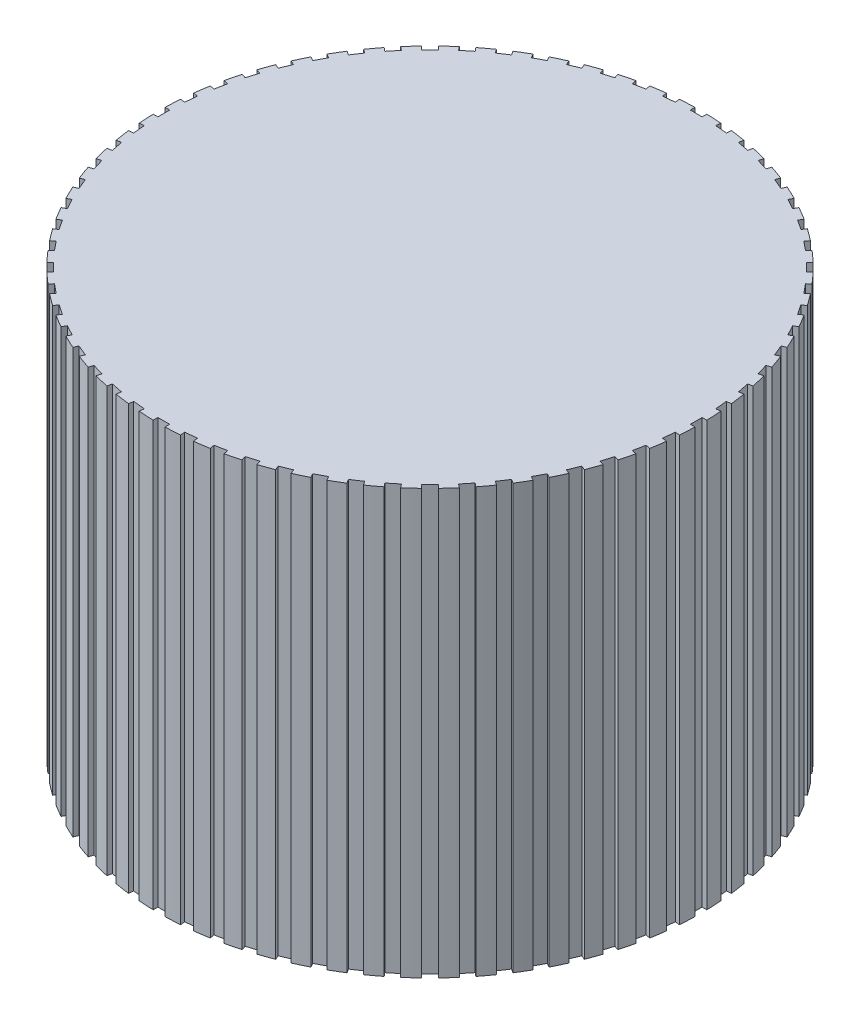
from build123d import *

# Parameters (mm, degrees)
SKETCH1_R           = 5.75
BOSS_EXTRUDE1_DEPTH = 5
BOSS_EXTRUDE2_START = -4
SKETCH1_3_R         = 5.75
SKETCH1_3_R_2       = 2.375
BOSS_EXTRUDE2_DEPTH = 4
SKETCH2_W           = 0.25
SKETCH2_H           = 0.5
SKETCH2_W_2         = 0.5
SKETCH2_H_2         = 0.25
CUT_EXTRUDE1_DEPTH  = 13.129509471


with BuildPart() as part:
    # Sketch1 → Boss-Extrude1 (new body)
    with BuildSketch(Plane(origin=(0, 0, 0), x_dir=(1, 0, 0), z_dir=(0, 1, 0))):
        Circle(SKETCH1_R)
    extrude(amount=BOSS_EXTRUDE1_DEPTH)

    # Sketch1<3> → Boss-Extrude2 (add)
    with BuildSketch(Plane(origin=(0, 0, 0), x_dir=(1, 0, 0), z_dir=(0, 1, 0)).offset(BOSS_EXTRUDE2_START)):
        Circle(SKETCH1_3_R)
        Circle(SKETCH1_3_R_2, mode=Mode.SUBTRACT)
    extrude(amount=BOSS_EXTRUDE2_DEPTH)

    # Sketch2 → Cut-Extrude1 (cut, through all)
    with BuildSketch(Plane.XZ.offset(4)):
        Polygon((0.478407322, 6.132638212), (0.429398752, 5.635045848), (0.678194934, 5.610541563), (0.727203504, 6.108133926), align=None)
        with Locations((0, 5.9)):
            Rectangle(SKETCH2_W, SKETCH2_H)
        Polygon((1.07720732, 6.056215765), (0.979662159, 5.565823125), (1.224858479, 5.517050544), (1.32240364, 6.007443184), align=None)
        Polygon((1.665633223, 5.921468649), (1.520490885, 5.442998482), (1.759725968, 5.370427312), (1.904868307, 5.84889748), align=None)
        Polygon((2.238018167, 5.729694554), (2.046676451, 5.267754788), (2.277646334, 5.17208393), (2.468988051, 5.634023696), align=None)
        Polygon((2.788849773, 5.482740368), (2.553151405, 5.041779736), (2.773631721, 4.923930551), (3.00933009, 5.364891184), align=None)
        Polygon((3.312823232, 5.182984395), (3.035038115, 4.767249589), (3.242905518, 4.62835703), (3.520690635, 5.044091837), align=None)
        Polygon((3.804892391, 4.833313449), (3.487695749, 4.446808222), (3.680948362, 4.288209901), (3.998145004, 4.674715128), align=None)
        Polygon((4.260318357, 4.437095052), (3.906764966, 4.083541661), (4.083541661, 3.906764966), (4.437095052, 4.260318357), align=None)
        Polygon((4.674715128, 3.998145004), (4.288209901, 3.680948362), (4.446808222, 3.487695749), (4.833313449, 3.804892391), align=None)
        Polygon((5.044091837, 3.520690635), (4.62835703, 3.242905518), (4.767249589, 3.035038115), (5.182984395, 3.312823232), align=None)
        Polygon((5.364891184, 3.00933009), (4.923930551, 2.773631721), (5.041779736, 2.553151405), (5.482740368, 2.788849773), align=None)
        Polygon((5.634023696, 2.468988051), (5.17208393, 2.277646334), (5.267754788, 2.046676451), (5.729694554, 2.238018167), align=None)
        Polygon((5.84889748, 1.904868307), (5.370427312, 1.759725968), (5.442998482, 1.520490885), (5.921468649, 1.665633223), align=None)
        Polygon((6.007443184, 1.32240364), (5.517050544, 1.224858479), (5.565823125, 0.979662159), (6.056215765, 1.07720732), align=None)
        Polygon((6.108133926, 0.727203504), (5.610541563, 0.678194934), (5.635045848, 0.429398752), (6.132638212, 0.478407322), align=None)
        with Locations((5.9, 0)):
            Rectangle(SKETCH2_W_2, SKETCH2_H_2)
        Polygon((6.132638212, -0.478407322), (5.635045848, -0.429398752), (5.610541563, -0.678194934), (6.108133926, -0.727203504), align=None)
        Polygon((6.056215765, -1.07720732), (5.565823125, -0.979662159), (5.517050544, -1.224858479), (6.007443184, -1.32240364), align=None)
        Polygon((5.921468649, -1.665633223), (5.442998482, -1.520490885), (5.370427312, -1.759725968), (5.84889748, -1.904868307), align=None)
        Polygon((5.729694554, -2.238018167), (5.267754788, -2.046676451), (5.17208393, -2.277646334), (5.634023696, -2.468988051), align=None)
        Polygon((5.482740368, -2.788849773), (5.041779736, -2.553151405), (4.923930551, -2.773631721), (5.364891184, -3.00933009), align=None)
        Polygon((5.182984395, -3.312823232), (4.767249589, -3.035038115), (4.62835703, -3.242905518), (5.044091837, -3.520690635), align=None)
        Polygon((4.833313449, -3.804892391), (4.446808222, -3.487695749), (4.288209901, -3.680948362), (4.674715128, -3.998145004), align=None)
        Polygon((4.437095052, -4.260318357), (4.083541661, -3.906764966), (3.906764966, -4.083541661), (4.260318357, -4.437095052), align=None)
        Polygon((3.998145004, -4.674715128), (3.680948362, -4.288209901), (3.487695749, -4.446808222), (3.804892391, -4.833313449), align=None)
        Polygon((3.520690635, -5.044091837), (3.242905518, -4.62835703), (3.035038115, -4.767249589), (3.312823232, -5.182984395), align=None)
        Polygon((3.00933009, -5.364891184), (2.773631721, -4.923930551), (2.553151405, -5.041779736), (2.788849773, -5.482740368), align=None)
        Polygon((2.468988051, -5.634023696), (2.277646334, -5.17208393), (2.046676451, -5.267754788), (2.238018167, -5.729694554), align=None)
        Polygon((1.904868307, -5.84889748), (1.759725968, -5.370427312), (1.520490885, -5.442998482), (1.665633223, -5.921468649), align=None)
        Polygon((1.32240364, -6.007443184), (1.224858479, -5.517050544), (0.979662159, -5.565823125), (1.07720732, -6.056215765), align=None)
        Polygon((0.727203504, -6.108133926), (0.678194934, -5.610541563), (0.429398752, -5.635045848), (0.478407322, -6.132638212), align=None)
        with Locations((0, -5.9)):
            Rectangle(SKETCH2_W, SKETCH2_H)
        Polygon((-0.478407322, -6.132638212), (-0.429398752, -5.635045848), (-0.678194934, -5.610541563), (-0.727203504, -6.108133926), align=None)
        Polygon((-1.07720732, -6.056215765), (-0.979662159, -5.565823125), (-1.224858479, -5.517050544), (-1.32240364, -6.007443184), align=None)
        Polygon((-1.665633223, -5.921468649), (-1.520490885, -5.442998482), (-1.759725968, -5.370427312), (-1.904868307, -5.84889748), align=None)
        Polygon((-2.238018167, -5.729694554), (-2.046676451, -5.267754788), (-2.277646334, -5.17208393), (-2.468988051, -5.634023696), align=None)
        Polygon((-2.788849773, -5.482740368), (-2.553151405, -5.041779736), (-2.773631721, -4.923930551), (-3.00933009, -5.364891184), align=None)
        Polygon((-3.312823232, -5.182984395), (-3.035038115, -4.767249589), (-3.242905518, -4.62835703), (-3.520690635, -5.044091837), align=None)
        Polygon((-3.804892391, -4.833313449), (-3.487695749, -4.446808222), (-3.680948362, -4.288209901), (-3.998145004, -4.674715128), align=None)
        Polygon((-4.260318357, -4.437095052), (-3.906764966, -4.083541661), (-4.083541661, -3.906764966), (-4.437095052, -4.260318357), align=None)
        Polygon((-4.674715128, -3.998145004), (-4.288209901, -3.680948362), (-4.446808222, -3.487695749), (-4.833313449, -3.804892391), align=None)
        Polygon((-5.044091837, -3.520690635), (-4.62835703, -3.242905518), (-4.767249589, -3.035038115), (-5.182984395, -3.312823232), align=None)
        Polygon((-5.364891184, -3.00933009), (-4.923930551, -2.773631721), (-5.041779736, -2.553151405), (-5.482740368, -2.788849773), align=None)
        Polygon((-5.634023696, -2.468988051), (-5.17208393, -2.277646334), (-5.267754788, -2.046676451), (-5.729694554, -2.238018167), align=None)
        Polygon((-5.84889748, -1.904868307), (-5.370427312, -1.759725968), (-5.442998482, -1.520490885), (-5.921468649, -1.665633223), align=None)
        Polygon((-6.007443184, -1.32240364), (-5.517050544, -1.224858479), (-5.565823125, -0.979662159), (-6.056215765, -1.07720732), align=None)
        Polygon((-6.108133926, -0.727203504), (-5.610541563, -0.678194934), (-5.635045848, -0.429398752), (-6.132638212, -0.478407322), align=None)
        with Locations((-5.9, 0)):
            Rectangle(SKETCH2_W_2, SKETCH2_H_2)
        Polygon((-6.132638212, 0.478407322), (-5.635045848, 0.429398752), (-5.610541563, 0.678194934), (-6.108133926, 0.727203504), align=None)
        Polygon((-6.056215765, 1.07720732), (-5.565823125, 0.979662159), (-5.517050544, 1.224858479), (-6.007443184, 1.32240364), align=None)
        Polygon((-5.921468649, 1.665633223), (-5.442998482, 1.520490885), (-5.370427312, 1.759725968), (-5.84889748, 1.904868307), align=None)
        Polygon((-5.729694554, 2.238018167), (-5.267754788, 2.046676451), (-5.17208393, 2.277646334), (-5.634023696, 2.468988051), align=None)
        Polygon((-5.482740368, 2.788849773), (-5.041779736, 2.553151405), (-4.923930551, 2.773631721), (-5.364891184, 3.00933009), align=None)
        Polygon((-5.182984395, 3.312823232), (-4.767249589, 3.035038115), (-4.62835703, 3.242905518), (-5.044091837, 3.520690635), align=None)
        Polygon((-4.833313449, 3.804892391), (-4.446808222, 3.487695749), (-4.288209901, 3.680948362), (-4.674715128, 3.998145004), align=None)
        Polygon((-4.437095052, 4.260318357), (-4.083541661, 3.906764966), (-3.906764966, 4.083541661), (-4.260318357, 4.437095052), align=None)
        Polygon((-3.998145004, 4.674715128), (-3.680948362, 4.288209901), (-3.487695749, 4.446808222), (-3.804892391, 4.833313449), align=None)
        Polygon((-3.520690635, 5.044091837), (-3.242905518, 4.62835703), (-3.035038115, 4.767249589), (-3.312823232, 5.182984395), align=None)
        Polygon((-3.00933009, 5.364891184), (-2.773631721, 4.923930551), (-2.553151405, 5.041779736), (-2.788849773, 5.482740368), align=None)
        Polygon((-2.468988051, 5.634023696), (-2.277646334, 5.17208393), (-2.046676451, 5.267754788), (-2.238018167, 5.729694554), align=None)
        Polygon((-1.904868307, 5.84889748), (-1.759725968, 5.370427312), (-1.520490885, 5.442998482), (-1.665633223, 5.921468649), align=None)
        Polygon((-1.32240364, 6.007443184), (-1.224858479, 5.517050544), (-0.979662159, 5.565823125), (-1.07720732, 6.056215765), align=None)
        Polygon((-0.727203504, 6.108133926), (-0.678194934, 5.610541563), (-0.429398752, 5.635045848), (-0.478407322, 6.132638212), align=None)
    extrude(amount=-CUT_EXTRUDE1_DEPTH, mode=Mode.SUBTRACT)


solid = part.part
